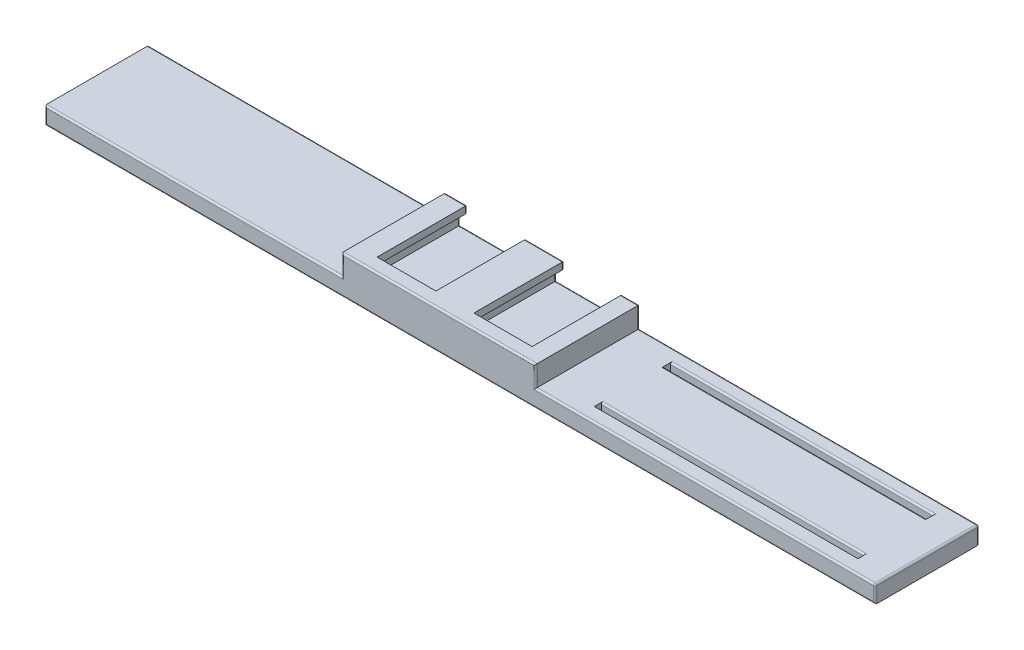
from build123d import *

# Parameters (mm, degrees)
SKETCH2_W                = 240
SKETCH2_H                = 30
BOSS_EXTRUDE1_DEPTH      = 5
BOSS_EXTRUDE2_DEPTH      = 6
BOSS_EXTRUDE3_DEPTH      = 2
BOSS_EXTRUDE3_DEPTH_BACK = 9
SKETCH4_W                = 26
SKETCH4_H                = 2
SKETCH5_W                = 26
SKETCH5_H                = 1.998827679
BOSS_EXTRUDE4_DEPTH      = 2
SKETCH6_W                = 26
SKETCH6_H                = 2
BOSS_EXTRUDE5_DEPTH      = 2
SKETCH8_W                = 76.2
SKETCH8_H                = 2
CUT_EXTRUDE1_DEPTH       = 6
SKETCH9_W                = 10
SKETCH9_H                = 1.3
CUT_EXTRUDE2_DEPTH       = 40
FILLET1_R                = 0.5


with BuildPart() as part:
    # Sketch2 → Boss-Extrude1 (new body)
    with BuildSketch(Plane(origin=(0, 0, 0), x_dir=(1, 0, 0), z_dir=(0, 1, 0))):
        with Locations((120, -15)):
            Rectangle(SKETCH2_W, SKETCH2_H)
    extrude(amount=BOSS_EXTRUDE1_DEPTH)

    # Sketch3 → Boss-Extrude2 (add)
    with BuildSketch(Plane(origin=(0, 5, 0), x_dir=(1, 0, 0), z_dir=(0, 1, 0))):
        Polygon((90, 0), (85.819507893, 0), (85.819507893, -30), (141.819507893, -30), (141.819507893, 0), (138.819507893, 0), (138.819507893, -26), (117.819507893, -26), (117.819507893, 0), (111, 0), (111, -26), (90, -26), align=None)
    extrude(amount=BOSS_EXTRUDE2_DEPTH)

    # Sketch4 → Boss-Extrude3 (add, two sides: drawn at the far end of the back side and taken through both)
    with BuildSketch(Plane.ZY.offset(-111).offset(-BOSS_EXTRUDE3_DEPTH_BACK)):
        with Locations((13, 10)):
            Rectangle(SKETCH4_W, SKETCH4_H)
    extrude(amount=BOSS_EXTRUDE3_DEPTH + BOSS_EXTRUDE3_DEPTH_BACK)

    # Sketch5 → Boss-Extrude4 (add)
    with BuildSketch(Plane(origin=(90, 0, 0), x_dir=(0, 0, -1), z_dir=(1, 0, 0))):
        with Locations((-13, 10.00058616)):
            Rectangle(SKETCH5_W, SKETCH5_H)
    extrude(amount=BOSS_EXTRUDE4_DEPTH)

    # Sketch6 → Boss-Extrude5 (add)
    with BuildSketch(Plane.ZY.offset(-138.819507893)):
        with Locations((13, 10)):
            Rectangle(SKETCH6_W, SKETCH6_H)
    extrude(amount=BOSS_EXTRUDE5_DEPTH)

    # Sketch8 → Cut-Extrude1 (cut)
    with BuildSketch(Plane(origin=(0, 5, 0), x_dir=(1, 0, 0), z_dir=(0, 1, 0))):
        with Locations((192.9, -25)):
            Rectangle(SKETCH8_W, SKETCH8_H)
        with Locations((192.9, -5)):
            Rectangle(SKETCH8_W, SKETCH8_H)
    extrude(amount=-CUT_EXTRUDE1_DEPTH, mode=Mode.SUBTRACT)

    # Sketch9 → Cut-Extrude2 (cut)
    with BuildSketch(Plane.ZY):
        with Locations((14.996078434, 0.65)):
            Rectangle(SKETCH9_W, SKETCH9_H)
        Polygon((21.2, 1.3), (21.2, 3.5), (15, 3.5), (8.8, 3.5), (8.8, 1.3), align=None)
    extrude(amount=-CUT_EXTRUDE2_DEPTH, mode=Mode.SUBTRACT)

    # Fillet1
    fillet1_edges = [part.edges().sort_by_distance(p)[0] for p in [
        (192.9, 0, 26),
        (42.909753947, 5, 30),
        (192.9, 5, 4),
        (192.9, 5, 6),
        (192.9, 5, 24),
        (240, 5, 15),
        (190.909753947, 5, 30),
        (100.5, 5, 0),
        (128.319507893, 5, 0),
        (190.909753947, 5, 0),
        (42.909753947, 5, 0),
        (85.819507893, 8, 0),
        (85.819507893, 8, 30),
        (141.819507893, 8, 30),
        (141.819507893, 8, 0),
        (113.819507893, 11, 30),
        (139.319507893, 11, 0),
        (114.5, 11, 0),
        (88.909753947, 11, 0),
        (111, 7, 0),
        (117.819507893, 7, 0),
        (118.909753947, 9, 0),
        (120, 10, 0),
        (120, 0, 0),
        (110, 9, 0),
        (109, 10, 0),
        (120, 0, 30),
        (90, 7.000586161, 0),
        (91, 9.001172321, 0),
        (92, 10.000586161, 0),
        (138.819507893, 7, 0),
        (0, 2.5, 0),
        (137.819507893, 9, 0),
        (240, 2.5, 0),
        (136.819507893, 10, 0),
        (240, 2.5, 30),
        (0, 2.5, 30),
    ]]
    fillet(fillet1_edges, radius=FILLET1_R)


solid = part.part
